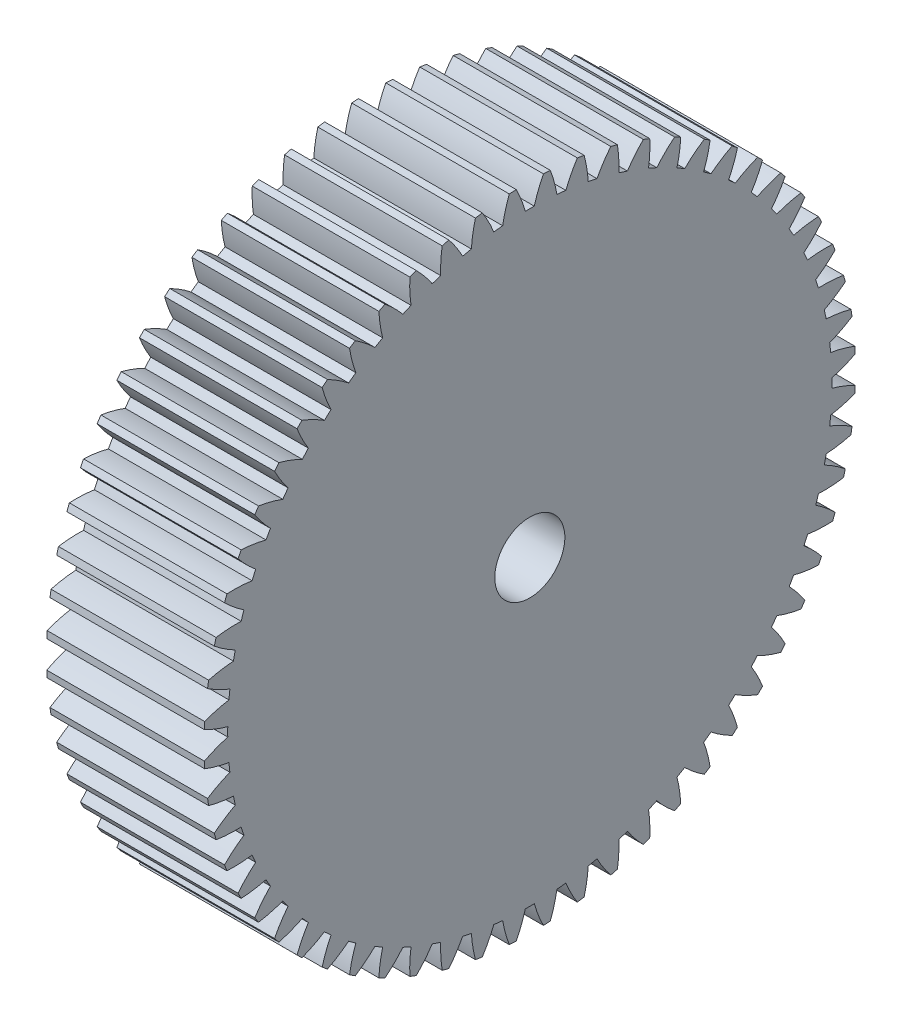
from build123d import *

# Parameters (mm, degrees)
BASPROSKE_W     = 45
BASPROSKE_H     = 93
TOOTHCUT_DEPTH  = 140.007194059
TEETHCUTS_COUNT = 60
TEETHCUTS_ANGLE = 354
BORSKE_R        = 10
BORE_DEPTH      = 50.0000508


with BuildPart() as part:
    # BasProSke → Base-Revolve (revolve)
    with BuildSketch(Plane(origin=(0, 0, 0), x_dir=(1, 0, 0), z_dir=(0, 1, 0)), mode=Mode.PRIVATE) as base_revolve_sk:
        with Locations((22.5, 46.5)):
            Rectangle(BASPROSKE_W, BASPROSKE_H)
    revolve(base_revolve_sk.sketch.rotate(Axis((-10, 0, 0), (1, 0, 0)), 180), axis=Axis((-10, 0, 0), (1, 0, 0)))

    # TooCutSke → ToothCut (cut, through all)
    with BuildSketch(Plane(origin=(0, 0, 0), x_dir=(0, 0, -1), z_dir=(1, 0, 0))):
        with BuildLine():
            ThreePointArc((1.279271233, 86.239512209), (0, 86.249), (-1.279271233, 86.239512209))
            ThreePointArc((-1.279271233, 86.239512209), (-2.42160022, 89.657227159), (-3.899887564, 92.943616898))
            ThreePointArc((-3.899887564, 92.943616898), (0, 93.0254), (3.899887564, 92.943616898))
            ThreePointArc((3.899887564, 92.943616898), (2.42160022, 89.657227159), (1.279271233, 86.239512209))
        make_face()
    toothcut = extrude(amount=TOOTHCUT_DEPTH, mode=Mode.SUBTRACT)

    # TeethCuts: ToothCut ×60 about axis
    teethcuts_axis = Axis((-10, 0, 0), (1, 0, 0))
    for i in range(1, TEETHCUTS_COUNT):
        add(toothcut.rotate(teethcuts_axis, i * TEETHCUTS_ANGLE / (TEETHCUTS_COUNT - 1)), mode=Mode.SUBTRACT)

    # BorSke → Bore (cut, symmetric)
    with BuildSketch(Plane(origin=(0, 0, 0), x_dir=(0, 0, -1), z_dir=(1, 0, 0))):
        with Locations(Location((0, 0, 0), (0, 0, 180))):
            Circle(BORSKE_R)
    extrude(amount=BORE_DEPTH, both=True, mode=Mode.SUBTRACT)


solid = part.part
